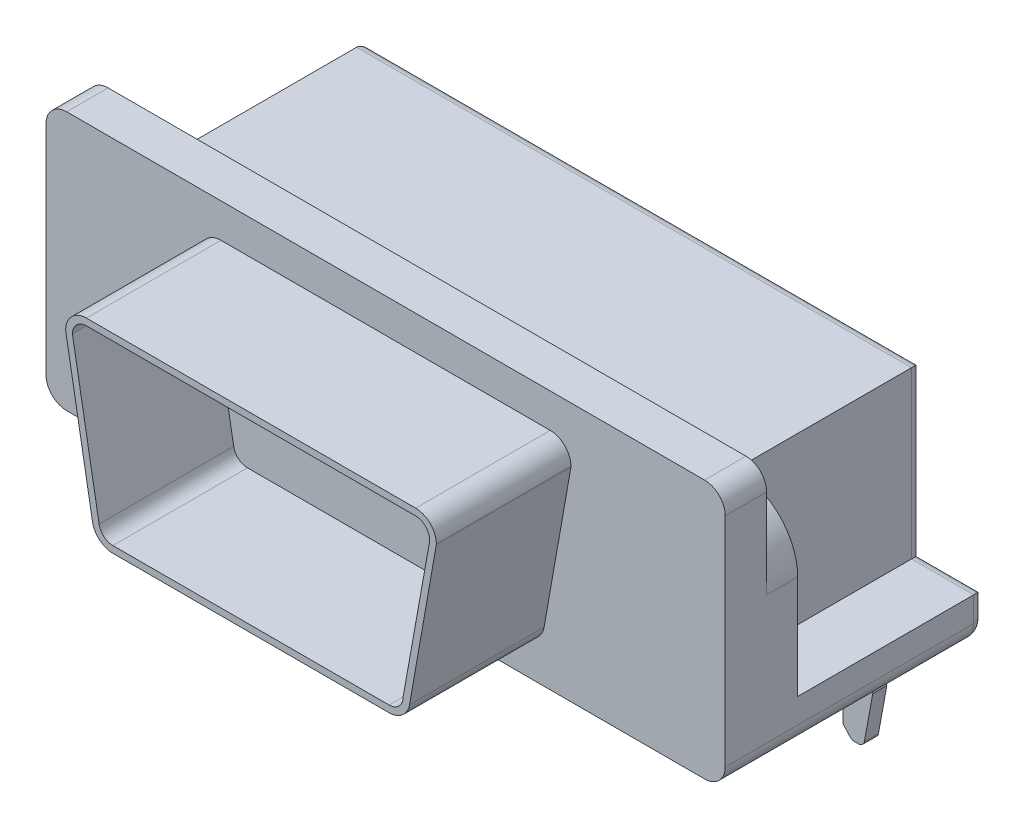
from build123d import *

# Parameters (mm, degrees)
SKETCH1_W             = 0.68
SKETCH1_H             = 0.68
BOSS_EXTRUDE1_DEPTH   = 3.2
BOSS_EXTRUDE1_2_DEPTH = 3.2
BOSS_EXTRUDE1_3_DEPTH = 3.2
BOSS_EXTRUDE1_4_DEPTH = 3.2
BOSS_EXTRUDE1_5_DEPTH = 3.2
BOSS_EXTRUDE1_6_DEPTH = 3.2
BOSS_EXTRUDE1_7_DEPTH = 3.2
BOSS_EXTRUDE1_8_DEPTH = 3.2
BOSS_EXTRUDE1_9_DEPTH = 3.2
SKETCH2_W             = 32.8
SKETCH2_H             = 12.5
BOSS_EXTRUDE2_DEPTH   = 12.5
FILLET1_R             = 1
SKETCH3_W             = 10.5
SKETCH3_H             = 2.3
CUT_EXTRUDE1_DEPTH    = 37.369223253
SKETCH4_W             = 3.7
SKETCH4_H             = 0.68
BOSS_EXTRUDE3_DEPTH   = 4
CUT_EXTRUDE5_DEPTH    = 23.571716816
FILLET2_R             = 0.3
BOSS_EXTRUDE4_DEPTH   = 6.5
FILLET3_R             = 1
CUT_EXTRUDE6_DEPTH    = 6.5
FILLET4_R             = 3
SKETCH12_W            = 3
SKETCH12_H            = 9
CUT_EXTRUDE7_DEPTH    = 8
FILLET5_R             = 0.5


with BuildPart() as part:
    # Sketch1 → Boss-Extrude1 (new body)
    with BuildSketch(Plane(origin=(0, 0, 0), x_dir=(1, 0, 0), z_dir=(0, 1, 0))):
        with Locations((1.385, -1.42)):
            Rectangle(SKETCH1_W, SKETCH1_H)
    extrude(amount=-BOSS_EXTRUDE1_DEPTH)



with BuildPart() as body_2:
    # Sketch1 → Boss-Extrude1 2 (new body)
    with BuildSketch(Plane(origin=(0, 0, 0), x_dir=(1, 0, 0), z_dir=(0, 1, 0))):
        with Locations((-1.385, -1.42)):
            Rectangle(SKETCH1_W, SKETCH1_H)
    extrude(amount=-BOSS_EXTRUDE1_2_DEPTH)


with BuildPart() as body_3:
    # Sketch1 → Boss-Extrude1 3 (new body)
    with BuildSketch(Plane(origin=(0, 0, 0), x_dir=(1, 0, 0), z_dir=(0, 1, 0))):
        with Locations((-5.54, 1.42)):
            Rectangle(SKETCH1_W, SKETCH1_H)
    extrude(amount=-BOSS_EXTRUDE1_3_DEPTH)


with BuildPart() as body_4:
    # Sketch1 → Boss-Extrude1 4 (new body)
    with BuildSketch(Plane(origin=(0, 0, 0), x_dir=(1, 0, 0), z_dir=(0, 1, 0))):
        with Locations((-2.77, 1.42)):
            Rectangle(SKETCH1_W, SKETCH1_H)
    extrude(amount=-BOSS_EXTRUDE1_4_DEPTH)


with BuildPart() as body_5:
    # Sketch1 → Boss-Extrude1 5 (new body)
    with BuildSketch(Plane(origin=(0, 0, 0), x_dir=(1, 0, 0), z_dir=(0, 1, 0))):
        with Locations((-4.155, -1.42)):
            Rectangle(SKETCH1_W, SKETCH1_H)
    extrude(amount=-BOSS_EXTRUDE1_5_DEPTH)


with BuildPart() as body_6:
    # Sketch1 → Boss-Extrude1 6 (new body)
    with BuildSketch(Plane(origin=(0, 0, 0), x_dir=(1, 0, 0), z_dir=(0, 1, 0))):
        with Locations((0, 1.42)):
            Rectangle(SKETCH1_W, SKETCH1_H)
    extrude(amount=-BOSS_EXTRUDE1_6_DEPTH)


with BuildPart() as body_7:
    # Sketch1 → Boss-Extrude1 7 (new body)
    with BuildSketch(Plane(origin=(0, 0, 0), x_dir=(1, 0, 0), z_dir=(0, 1, 0))):
        with Locations((4.155, -1.42)):
            Rectangle(SKETCH1_W, SKETCH1_H)
    extrude(amount=-BOSS_EXTRUDE1_7_DEPTH)


with BuildPart() as body_8:
    # Sketch1 → Boss-Extrude1 8 (new body)
    with BuildSketch(Plane(origin=(0, 0, 0), x_dir=(1, 0, 0), z_dir=(0, 1, 0))):
        with Locations((5.54, 1.42)):
            Rectangle(SKETCH1_W, SKETCH1_H)
    extrude(amount=-BOSS_EXTRUDE1_8_DEPTH)


with BuildPart() as body_9:
    # Sketch1 → Boss-Extrude1 9 (new body)
    with BuildSketch(Plane(origin=(0, 0, 0), x_dir=(1, 0, 0), z_dir=(0, 1, 0))):
        with Locations((2.77, 1.42)):
            Rectangle(SKETCH1_W, SKETCH1_H)
    extrude(amount=-BOSS_EXTRUDE1_9_DEPTH)


with BuildPart() as part_1:
    add(part.part)

    add(body_2.part)  # Boss-Extrude2 merges body 2

    add(body_3.part)  # Boss-Extrude2 merges body 3

    add(body_4.part)  # Boss-Extrude2 merges body 4

    add(body_5.part)  # Boss-Extrude2 merges body 5

    add(body_6.part)  # Boss-Extrude2 merges body 6

    add(body_7.part)  # Boss-Extrude2 merges body 7

    add(body_8.part)  # Boss-Extrude2 merges body 8

    add(body_9.part)  # Boss-Extrude2 merges body 9
    # Sketch2 → Boss-Extrude2 (add)
    with BuildSketch(Plane(origin=(0, 0, 0), x_dir=(1, 0, 0), z_dir=(0, 1, 0))):
        with Locations((0, -3.27)):
            Rectangle(SKETCH2_W, SKETCH2_H)
    extrude(amount=BOSS_EXTRUDE2_DEPTH)

    # Fillet1
    fillet1_edges = [part_1.edges().sort_by_distance(p)[0] for p in [
        (-16.4, 0, 3.27),
        (16.4, 0, 3.27),
        (-16.4, 12.5, 3.27),
        (16.4, 12.5, 3.27),
    ]]
    fillet(fillet1_edges, radius=FILLET1_R)

    # Sketch3 → Cut-Extrude1 (cut, through all)
    with BuildSketch(Plane(origin=(16.4, 0, 0), x_dir=(0, 0, -1), z_dir=(1, 0, 0))):
        with Locations((-2.27, 11.35)):
            Rectangle(SKETCH3_W, SKETCH3_H)
    extrude(amount=-CUT_EXTRUDE1_DEPTH, mode=Mode.SUBTRACT)

    # Sketch4 → Boss-Extrude3 (add)
    with BuildSketch(Plane.XZ):
        with Locations((-12.495, 0)):
            Rectangle(SKETCH4_W, SKETCH4_H)
        with Locations((12.495, 0)):
            Rectangle(SKETCH4_W, SKETCH4_H)
    extrude(amount=BOSS_EXTRUDE3_DEPTH)

    # Sketch6 → Cut-Extrude5 (cut, through all)
    with BuildSketch(Plane.XY.offset(0.34)):
        Polygon((-14.345, -1.550750234), (-13.813289593, -0.780582126), (-13.813289593, 0), (-14.345, 0), (-14.827308736, 0), (-14.827308736, -4), (-13.896384817, -4), align=None)
        Polygon((-12.907050916, 0), (-12.082949084, 0), (-12.082949084, -3.533172452), (-11.651133602, -4), (-13.338866398, -4), (-12.907050916, -3.533172452), align=None)
        Polygon((-11.176710407, 0), (-10.645, 0), (-10.162691264, 0), (-10.162691264, -4), (-11.093615183, -4), (-10.645, -1.550750234), (-11.176710407, -0.780582126), align=None)
        Polygon((10.645, -1.550750234), (11.176710407, -0.780582126), (11.176710407, 0), (10.645, 0), (10.162691264, 0), (10.162691264, -4), (11.093615183, -4), align=None)
        Polygon((12.082949084, 0), (12.082949084, -3.533172452), (11.651133602, -4), (13.338866398, -4), (12.907050916, -3.533172452), (12.907050916, 0), align=None)
        Polygon((13.813289593, 0), (14.345, 0), (14.827308736, 0), (14.827308736, -4), (13.896384817, -4), (14.345, -1.550750234), (13.813289593, -0.780582126), align=None)
    extrude(amount=-CUT_EXTRUDE5_DEPTH, mode=Mode.SUBTRACT)

    # Fillet2
    fillet2_edges = [part_1.edges().sort_by_distance(p)[0] for p in [
        (13.896384817, -4, 0),
        (11.093615183, -4, 0),
        (11.651133602, -4, 0),
        (13.338866398, -4, 0),
        (-13.338866398, -4, 0),
        (-11.651133602, -4, 0),
        (-11.093615183, -4, 0),
        (-13.896384817, -4, 0),
    ]]
    fillet(fillet2_edges, radius=FILLET2_R)

    # Sketch7 → Boss-Extrude4 (add)
    with BuildSketch(Plane.XY.offset(9.52)):
        Polygon((-8.95, 10.85), (8.95, 10.85), (8.95, 9.82390435), (7.508720125, 1.65), (-7.508720125, 1.65), (-8.95, 9.82390435), align=None)
    extrude(amount=BOSS_EXTRUDE4_DEPTH)

    # Fillet3
    fillet3_edges = [part_1.edges().sort_by_distance(p)[0] for p in [
        (-8.95, 10.85, 12.77),
        (-7.508720125, 1.65, 12.77),
        (7.508720125, 1.65, 12.77),
        (8.95, 10.85, 12.77),
    ]]
    fillet(fillet3_edges, radius=FILLET3_R)

    # Sketch10 → Cut-Extrude6 (cut)
    with BuildSketch(Plane.XY.offset(16.02)):
        with BuildLine():
            Line((-8.625, 9.85), (-7.335651287, 2.540327837))
            ThreePointArc((-7.335651287, 2.540327837), (-7.106424964, 2.135386694), (-6.669620494, 1.975))
            Line((-6.669620494, 1.975), (6.669620494, 1.975))
            ThreePointArc((6.669620494, 1.975), (7.146917571, 2.172702923), (7.344620494, 2.65))
            Line((7.344620494, 2.65), (8.621293798, 9.779362644))
            ThreePointArc((8.621293798, 9.779362644), (8.451649886, 10.301633028), (7.95, 10.525))
            Line((7.95, 10.525), (-7.95, 10.525))
            ThreePointArc((-7.95, 10.525), (-8.427297077, 10.327297077), (-8.625, 9.85))
        make_face()
    extrude(amount=-CUT_EXTRUDE6_DEPTH, mode=Mode.SUBTRACT)

    # Fillet4
    fillet4_edges = [part_1.edges().sort_by_distance(p)[0] for p in [
        (-16.4, 10.2, 2.27),
        (16.4, 10.2, 2.27),
    ]]
    fillet(fillet4_edges, radius=FILLET4_R)

    # Sketch12 → Cut-Extrude7 (cut)
    with BuildSketch(Plane(origin=(0, 10.2, 0), x_dir=(1, 0, 0), z_dir=(0, 1, 0))):
        with Locations((-14.9, -1.52)):
            Rectangle(SKETCH12_W, SKETCH12_H)
        with Locations((14.9, -1.52)):
            Rectangle(SKETCH12_W, SKETCH12_H)
    extrude(amount=-CUT_EXTRUDE7_DEPTH, mode=Mode.SUBTRACT)

    # Fillet5
    fillet5_edges = [part_1.edges().sort_by_distance(p)[0] for p in [
        (0, 0, -2.98),
        (-16.107106781, 0.292893219, -2.98),
        (16.107106781, 0.292893219, -2.98),
        (0, 10.2, -2.98),
        (16.4, 1.6, -2.98),
        (-16.4, 1.6, -2.98),
        (-14.9, 2.2, -2.98),
        (-13.4, 6.2, -2.98),
        (14.9, 2.2, -2.98),
        (13.4, 6.2, -2.98),
    ]]
    fillet(fillet5_edges, radius=FILLET5_R)


solid = part_1.part
